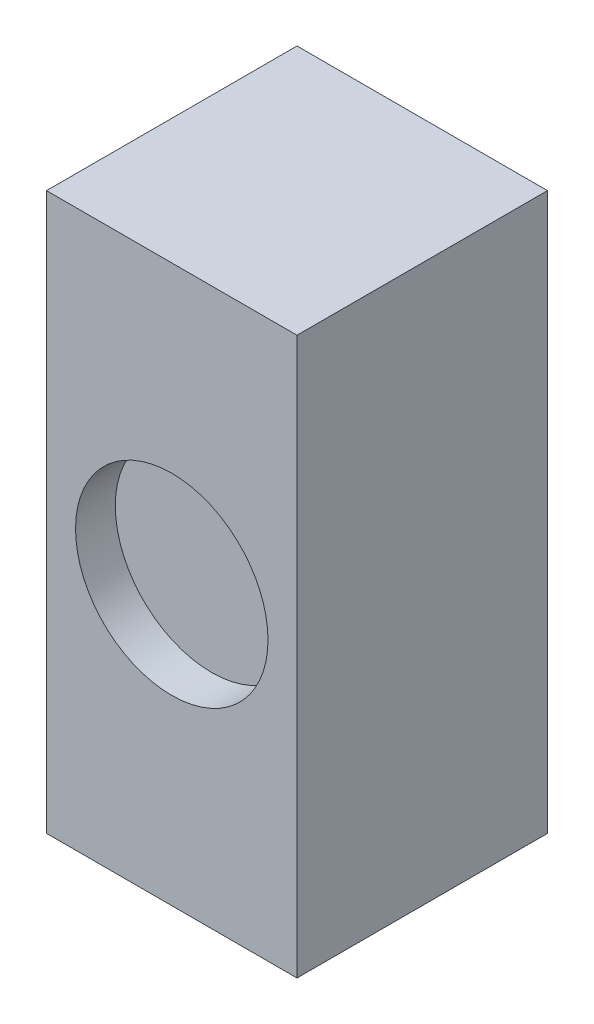
from build123d import *

# Parameters (mm, degrees)
BOSS_EXTRUDE1_DEPTH = 355.6
SKETCH3_R           = 61.468
CUT_EXTRUDE1_DEPTH  = 25.4


with BuildPart() as part:
    # Sketch1 → Boss-Extrude1 (new body)
    with BuildSketch(Plane(origin=(0, 0, 0), x_dir=(1, 0, 0), z_dir=(0, 1, 0))):
        Polygon((0, 80), (-80, 80), (-80, 0), (-80, -80), (0, -80), (80, -80), (80, 0), (80, 80), align=None)
    extrude(amount=BOSS_EXTRUDE1_DEPTH)

    # Sketch3 → Cut-Extrude1 (cut)
    with BuildSketch(Plane.XY.offset(80)):
        with Locations((0, 177.8)):
            Circle(SKETCH3_R)
    extrude(amount=-CUT_EXTRUDE1_DEPTH, mode=Mode.SUBTRACT)


solid = part.part
